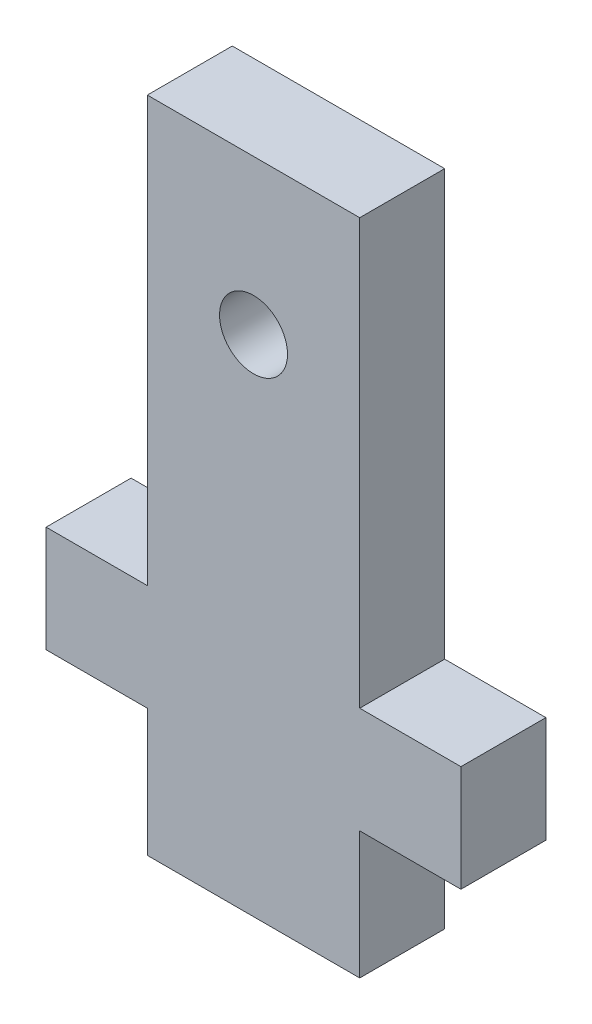
from build123d import *

# Parameters (mm, degrees)
BOSS_EXTRUDE1_DEPTH = 5.08
SKETCH2_R           = 2.032
CUT_EXTRUDE1_DEPTH  = 7.62


with BuildPart() as part:
    # Sketch1 → Boss-Extrude1 (new body)
    with BuildSketch(Plane.XY):
        Polygon((0, 0), (12.7, 0), (12.7, 7.62), (18.751410658, 7.62), (18.751410658, 13.97), (12.7, 13.97), (12.7, 39.37), (0, 39.37), (0, 13.97), (-6.051410658, 13.97), (-6.051410658, 7.62), (0, 7.62), align=None)
    extrude(amount=BOSS_EXTRUDE1_DEPTH)

    # Sketch2 → Cut-Extrude1 (cut)
    with BuildSketch(Plane.XY.offset(5.08)):
        with Locations((6.35, 30.140865425)):
            Circle(SKETCH2_R)
    extrude(amount=-CUT_EXTRUDE1_DEPTH, mode=Mode.SUBTRACT)


solid = part.part
